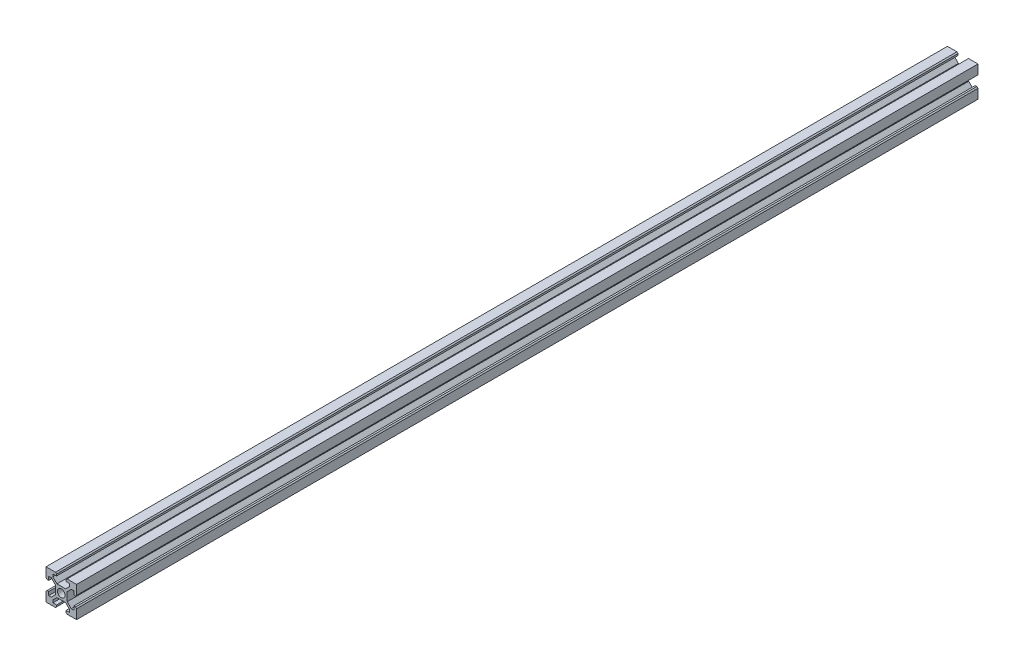
from build123d import *

# Parameters (mm, degrees)
SKETCH1_R           = 2.5
BOSS_EXTRUDE1_DEPTH = 295


with BuildPart() as part:
    # Sketch1 → Boss-Extrude1 (new, symmetric)
    with BuildSketch(Plane.XY):
        Polygon((3.9, -2.839339828), (6.560660172, -5.5), (8.200660172, -5.5), (8.200660172, -3.1), (9.3, -3.1), (10, -3.8), (10, -10), (3.8, -10), (3.1, -9.3), (3.1, -8.200660172), (5.5, -8.200660172), (5.5, -6.560660172), (2.839339828, -3.9), (-2.839339828, -3.9), (-5.5, -6.560660172), (-5.5, -8.200660172), (-3.1, -8.200660172), (-3.1, -9.3), (-3.8, -10), (-10, -10), (-10, -3.8), (-9.3, -3.1), (-8.200660172, -3.1), (-8.200660172, -5.5), (-6.560660172, -5.5), (-3.9, -2.839339828), (-3.9, 2.839339828), (-6.560660172, 5.5), (-8.200660172, 5.5), (-8.200660172, 3.1), (-9.3, 3.1), (-10, 3.8), (-10, 10), (-3.8, 10), (-3.1, 9.3), (-3.1, 8.200660172), (-5.5, 8.200660172), (-5.5, 6.560660172), (-2.839339828, 3.9), (2.839339828, 3.9), (5.5, 6.560660172), (5.5, 8.200660172), (3.1, 8.200660172), (3.1, 9.3), (3.8, 10), (10, 10), (10, 3.8), (9.3, 3.1), (8.200660172, 3.1), (8.200660172, 5.5), (6.560660172, 5.5), (3.9, 2.839339828), align=None)
        Circle(SKETCH1_R, mode=Mode.SUBTRACT)
    extrude(amount=BOSS_EXTRUDE1_DEPTH, both=True)


solid = part.part
